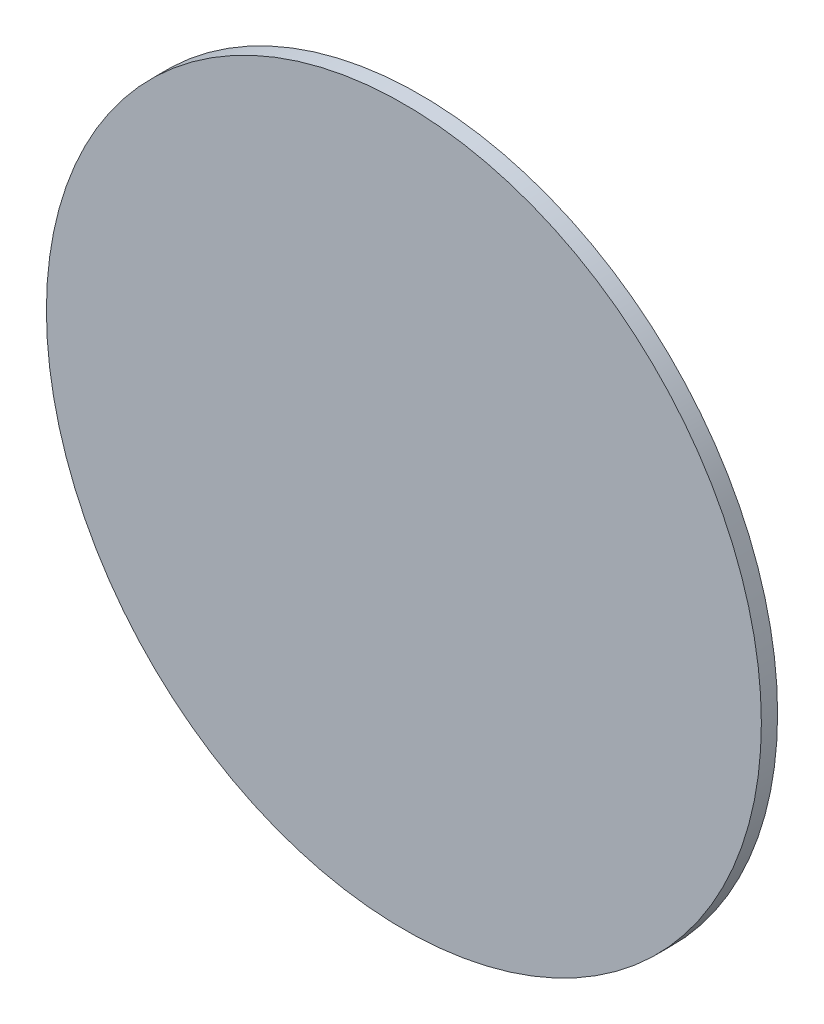
from build123d import *

# Parameters (mm, degrees)
SKETCH1_R           = 22.025
BOSS_EXTRUDE1_DEPTH = 1


with BuildPart() as part:
    # Sketch1 → Boss-Extrude1 (new body)
    with BuildSketch(Plane.XY):
        Circle(SKETCH1_R)
    extrude(amount=BOSS_EXTRUDE1_DEPTH)


solid = part.part
